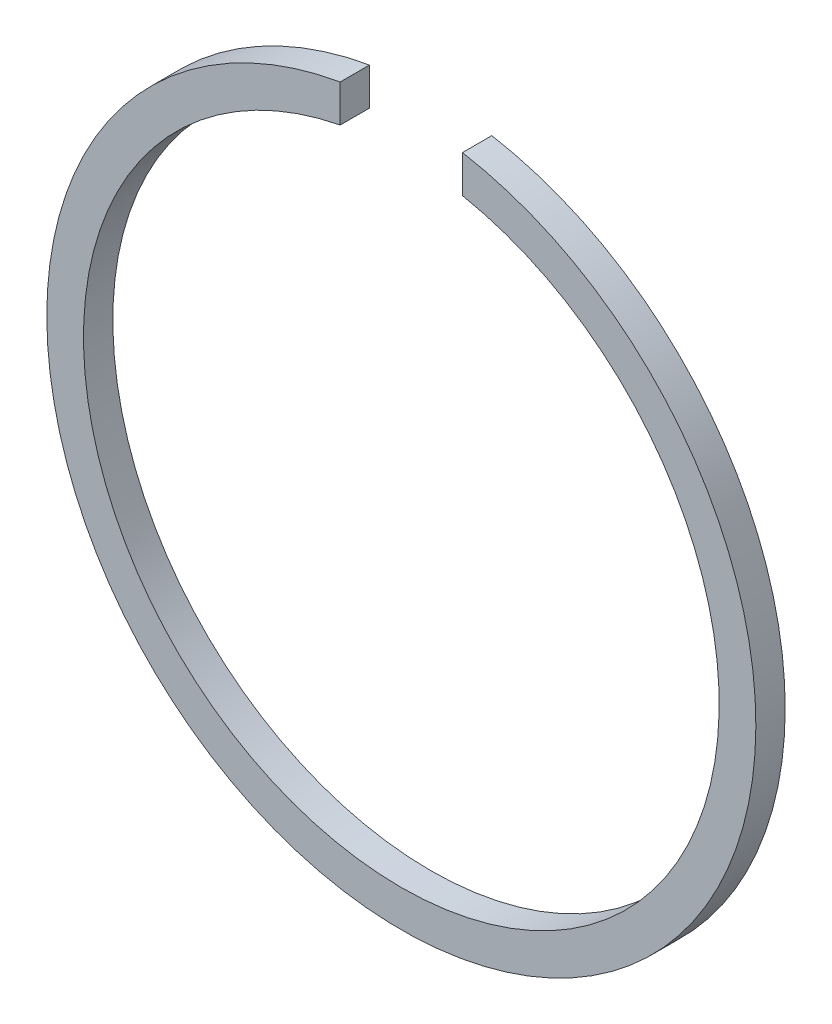
from build123d import *

# Parameters (mm, degrees)
BOSS_EXTRUDE1_DEPTH = 1.2


with BuildPart() as part:
    # Sketch1 → Boss-Extrude1 (new body)
    with BuildSketch(Plane.XY):
        with BuildLine():
            Line((2.5, 12.757350822), (2.5, 14.282856857))
            ThreePointArc((2.5, 14.282856857), (0, -14.5), (-2.5, 14.282856857))
            Line((-2.5, 14.282856857), (-2.5, 12.757350822))
            ThreePointArc((-2.5, 12.757350822), (0, -13), (2.5, 12.757350822))
        make_face()
    extrude(amount=BOSS_EXTRUDE1_DEPTH)


solid = part.part
